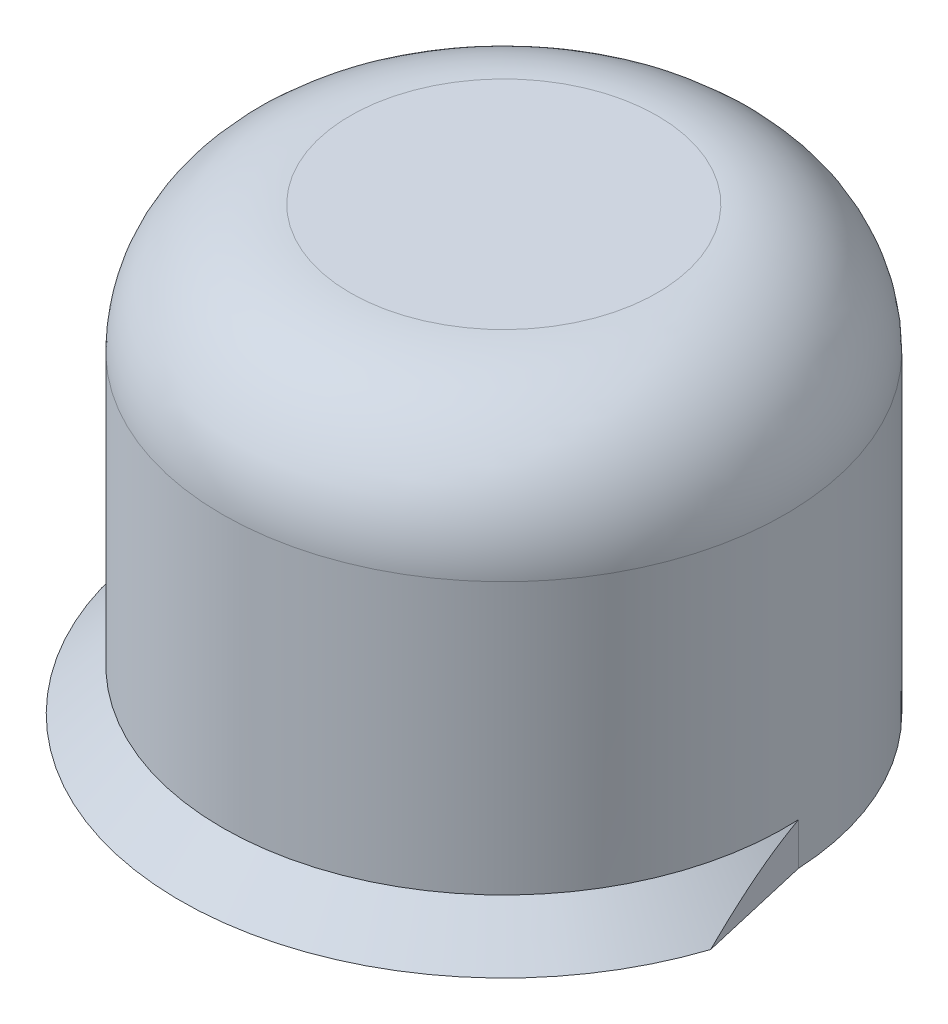
from build123d import *
from build123d.topology import SkipClean

# Parameters (mm, degrees)
CUT_EXTRUDE1_REACH = 11.939


with BuildPart() as part:
    # Sketch2 → Revolve1 (revolve)
    with BuildSketch(Plane(origin=(0, 0, 0), x_dir=(0, 0, -1), z_dir=(1, 0, 0)), mode=Mode.PRIVATE) as revolve1_sk:
        with BuildLine():
            Line((2.4, 7), (0, 7))
            Line((0, 7), (0, 6))
            Line((0, 6), (0.1, 6))
            Line((0.1, 6), (1.379705, 6))
            ThreePointArc((1.379705, 6), (1.589297, 5.914642), (1.67962, 5.707141))
            Line((1.67962, 5.707141), (1.813124, 0.1))
            Line((1.813124, 0.1), (5.058579, 0.1))
            Line((5.058579, 0.1), (4.4, 0.758579))
            Line((4.4, 0.758579), (4.4, 5))
            ThreePointArc((4.4, 5), (3.814214, 6.414214), (2.4, 7))
        make_face()
    revolve(revolve1_sk.sketch.rotate(Axis((0, 7, 0), (0, -1, 0)), 180), axis=Axis((0, 7, 0), (0, -1, 0)))

    # Sketch39 → Cut-Extrude1 (cut, up to next)
    with BuildSketch(Plane.XZ.offset(-0.1), mode=Mode.PRIVATE) as cut_extrude1_sk1:
        with BuildLine():
            Line((4.850193, 1.75686), (4.394822, -0.213404))
            ThreePointArc((4.394822, -0.213404), (3.32364, -2.8833), (0.831709, -4.320678))
            ThreePointArc((0.831709, -4.320678), (0.26417, -4.685895), (-0.222202, -5.153791))
            ThreePointArc((-0.222202, -5.153791), (4.158588, -3.05239), (4.850193, 1.75686))
        make_face()
    cut_extrude1_tool1 = extrude(cut_extrude1_sk1.sketch, amount=-CUT_EXTRUDE1_REACH, mode=Mode.PRIVATE) & part.part
    add(cut_extrude1_tool1.solids().sort_by_distance((4.087951, 0.1, -3.000543))[0], mode=Mode.SUBTRACT)


solid = part.part
